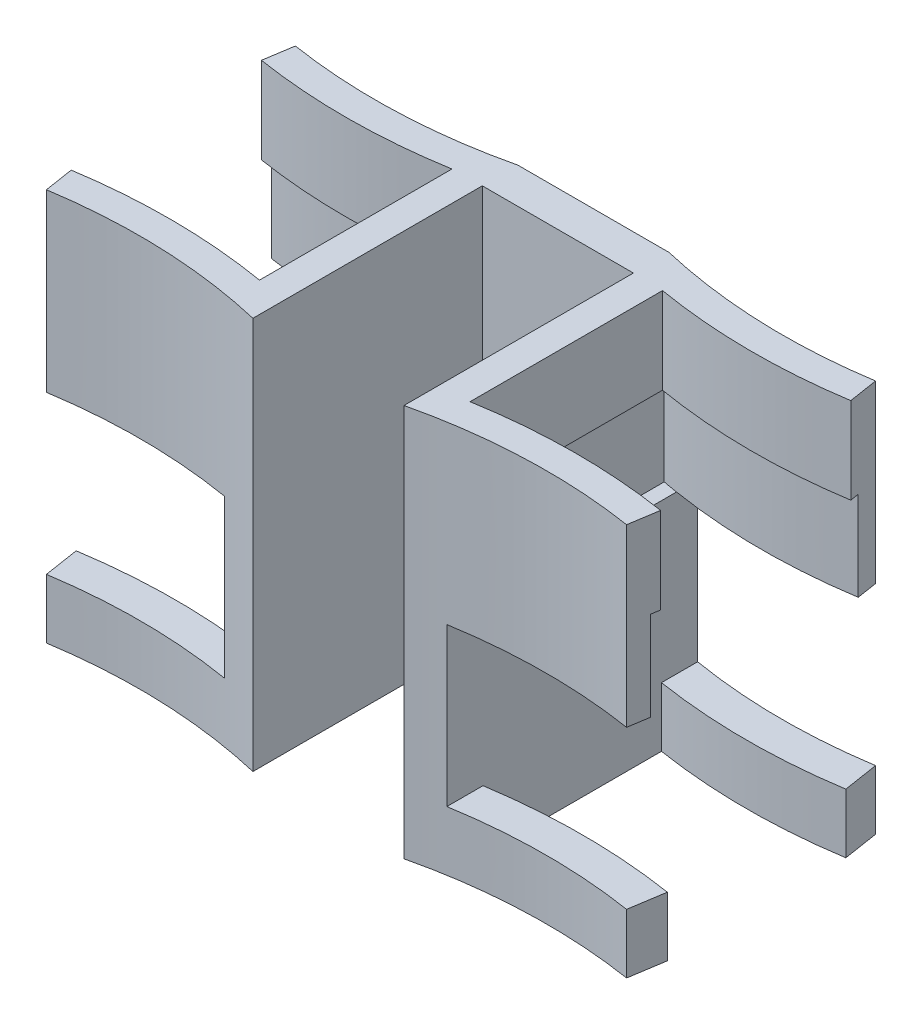
from build123d import *

# Parameters (mm, degrees)
BOSS_EXTRUDE1_DEPTH = 66
CUT_EXTRUDE1_START  = -15
CUT_EXTRUDE1_DEPTH  = 15
CUT_EXTRUDE2_START  = -14.5
CUT_EXTRUDE2_DEPTH  = 15
SKETCH4_W           = 44.566501288
SKETCH4_H           = 26.5
CUT_EXTRUDE3_DEPTH  = 103.576483765
SKETCH5_W           = 44.566501288
SKETCH5_H           = 26.5
CUT_EXTRUDE4_DEPTH  = 103.576483765


with BuildPart() as part:
    # Sketch1 → Boss-Extrude1 (new body)
    with BuildSketch(Plane(origin=(0, 0, 0), x_dir=(1, 0, 0), z_dir=(0, 1, 0))):
        with BuildLine():
            Line((-6, -1.283250644), (-6, -31.283250644))
            ThreePointArc((-6, -31.283250644), (-21.5, -30.074697642), (-37, -31.283250644))
            Line((-37, -31.283250644), (-36.07, -37.210737464))
            ThreePointArc((-36.07, -37.210737464), (-17.969313256, -36.14102822), (0, -38.566501288))
            Line((0, -38.566501288), (0, 0))
            Line((0, 0), (25.4, 0))
            Line((25.4, 0), (25.4, -38.566501288))
            ThreePointArc((25.4, -38.566501288), (43.369313256, -36.14102822), (61.47, -37.210737464))
            Line((61.47, -37.210737464), (62.4, -31.283250644))
            ThreePointArc((62.4, -31.283250644), (46.9, -30.074697642), (31.4, -31.283250644))
            Line((31.4, -31.283250644), (31.4, -1.283250644))
            ThreePointArc((31.4, -1.283250644), (46.9, -2.491803646), (62.4, -1.283250644))
            Line((62.4, -1.283250644), (61.47, 4.644236176))
            ThreePointArc((61.47, 4.644236176), (43.369313256, 3.574526932), (25.4, 6))
            Line((25.4, 6), (0, 6))
            ThreePointArc((0, 6), (-17.969313256, 3.574526932), (-36.07, 4.644236176))
            Line((-36.07, 4.644236176), (-37, -1.283250644))
            ThreePointArc((-37, -1.283250644), (-21.5, -2.491803646), (-6, -1.283250644))
        make_face()
    extrude(amount=BOSS_EXTRUDE1_DEPTH)

    # Sketch2 → Cut-Extrude1 (cut)
    # profile 1 of 2: a face of its own
    with BuildSketch(Plane(origin=(0, 66, 0), x_dir=(1, 0, 0), z_dir=(0, 1, 0)).offset(CUT_EXTRUDE1_START)):
        with BuildLine():
            Line((-5, -0.107120067), (-5, -32.459381221))
            ThreePointArc((-5, -32.459381221), (-21.5, -31.074697642), (-38, -32.459381221))
            Line((-38, -32.459381221), (-38, -0.107120067))
            ThreePointArc((-38, -0.107120067), (-21.5, -1.491803646), (-5, -0.107120067))
        make_face()
        with BuildLine():
            Line((-6, -1.283250644), (-6, -31.283250644))
            ThreePointArc((-6, -31.283250644), (-21.5, -30.074697642), (-37, -31.283250644))
            Line((-37, -31.283250644), (-37, -1.283250644))
            ThreePointArc((-37, -1.283250644), (-21.5, -2.491803646), (-6, -1.283250644))
        make_face(mode=Mode.SUBTRACT)
    # profile 2 of 2: a face of its own
    with BuildSketch(Plane(origin=(0, 66, 0), x_dir=(1, 0, 0), z_dir=(0, 1, 0)).offset(CUT_EXTRUDE1_START)):
        with BuildLine():
            Line((63.4, -0.107120067), (63.4, -32.459381221))
            ThreePointArc((63.4, -32.459381221), (46.9, -31.074697642), (30.4, -32.459381221))
            Line((30.4, -32.459381221), (30.4, -0.107120067))
            ThreePointArc((30.4, -0.107120067), (46.9, -1.491803646), (63.4, -0.107120067))
        make_face()
        with BuildLine():
            Line((31.4, -1.283250644), (31.4, -31.283250644))
            ThreePointArc((31.4, -31.283250644), (46.9, -30.074697642), (62.4, -31.283250644))
            Line((62.4, -31.283250644), (62.4, -1.283250644))
            ThreePointArc((62.4, -1.283250644), (46.9, -2.491803646), (31.4, -1.283250644))
        make_face(mode=Mode.SUBTRACT)
    extrude(amount=CUT_EXTRUDE1_DEPTH, mode=Mode.SUBTRACT)

    # Sketch3 → Cut-Extrude2 (cut)
    # profile 1 of 2: a face of its own
    with BuildSketch(Plane(origin=(0, 51, 0), x_dir=(1, 0, 0), z_dir=(0, 1, 0)).offset(CUT_EXTRUDE2_START)):
        with BuildLine():
            Line((-3.5, 1.684138832), (-3.5, -34.25064012))
            ThreePointArc((-3.5, -34.25064012), (-21.5, -32.574697642), (-39.5, -34.25064012))
            Line((-39.5, -34.25064012), (-39.5, 1.684138832))
            ThreePointArc((-39.5, 1.684138832), (-21.5, 0.008196354), (-3.5, 1.684138832))
        make_face()
        with BuildLine():
            Line((-37, -1.283250644), (-37, -31.283250644))
            ThreePointArc((-37, -31.283250644), (-21.5, -30.074697642), (-6, -31.283250644))
            Line((-6, -31.283250644), (-6, -1.283250644))
            ThreePointArc((-6, -1.283250644), (-21.5, -2.491803646), (-37, -1.283250644))
        make_face(mode=Mode.SUBTRACT)
    # profile 2 of 2: a face of its own
    with BuildSketch(Plane(origin=(0, 51, 0), x_dir=(1, 0, 0), z_dir=(0, 1, 0)).offset(CUT_EXTRUDE2_START)):
        with BuildLine():
            Line((64.9, 1.684138832), (64.9, -34.25064012))
            ThreePointArc((64.9, -34.25064012), (46.9, -32.574697642), (28.9, -34.25064012))
            Line((28.9, -34.25064012), (28.9, 1.684138832))
            ThreePointArc((28.9, 1.684138832), (46.9, 0.008196354), (64.9, 1.684138832))
        make_face()
        with BuildLine():
            Line((31.4, -1.283250644), (31.4, -31.283250644))
            ThreePointArc((31.4, -31.283250644), (46.9, -30.074697642), (62.4, -31.283250644))
            Line((62.4, -31.283250644), (62.4, -1.283250644))
            ThreePointArc((62.4, -1.283250644), (46.9, -2.491803646), (31.4, -1.283250644))
        make_face(mode=Mode.SUBTRACT)
    extrude(amount=CUT_EXTRUDE2_DEPTH, mode=Mode.SUBTRACT)

    # Sketch4 → Cut-Extrude3 (cut, through all)
    with BuildSketch(Plane.ZY.offset(6)):
        with Locations((16.283250644, 23.25)):
            Rectangle(SKETCH4_W, SKETCH4_H)
    extrude(amount=CUT_EXTRUDE3_DEPTH, mode=Mode.SUBTRACT)

    # Sketch5 → Cut-Extrude4 (cut, through all)
    with BuildSketch(Plane(origin=(31.4, 0, 0), x_dir=(0, 0, -1), z_dir=(1, 0, 0))):
        with Locations((-16.283250644, 23.25)):
            Rectangle(SKETCH5_W, SKETCH5_H)
    extrude(amount=CUT_EXTRUDE4_DEPTH, mode=Mode.SUBTRACT)


solid = part.part
